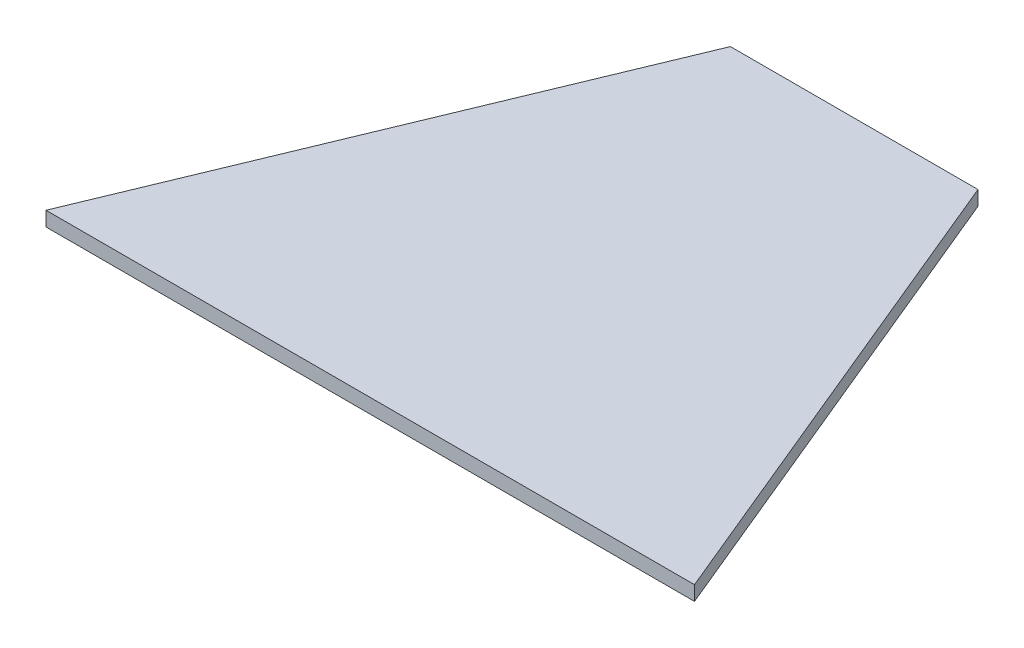
from build123d import *

# Parameters (mm, degrees)
BOSS_EXTRUDE1_DEPTH = 3


with BuildPart() as part:
    # Sketch1 → Boss-Extrude1 (new body)
    with BuildSketch(Plane(origin=(0, 0, 0), x_dir=(1, 0, 0), z_dir=(0, 1, 0))):
        Polygon((0, 0), (134, 0), (92.578643763, 100), (41.421356237, 100), align=None)
    extrude(amount=BOSS_EXTRUDE1_DEPTH)


solid = part.part
